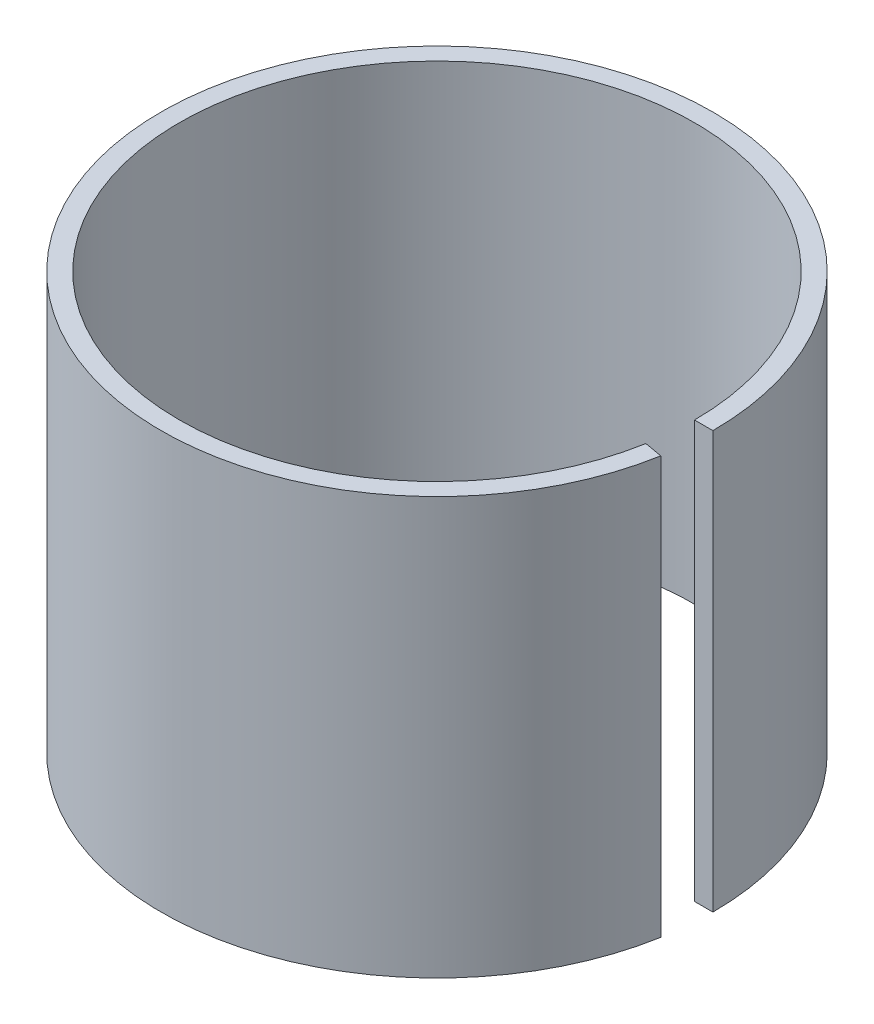
from build123d import *

# Parameters (mm, degrees)
SKETCH1_W           = 1.5
SKETCH1_H           = 34
REVOLVE_THIN1_ANGLE = 350


with BuildPart() as part:
    # Sketch1 → Revolve-Thin1 (revolve)
    with BuildSketch(Plane.XY):
        with Locations((21.75, 17)):
            Rectangle(SKETCH1_W, SKETCH1_H)
    revolve(axis=Axis((0, 0, 0), (0, 1, 0)), revolution_arc=REVOLVE_THIN1_ANGLE)


solid = part.part
